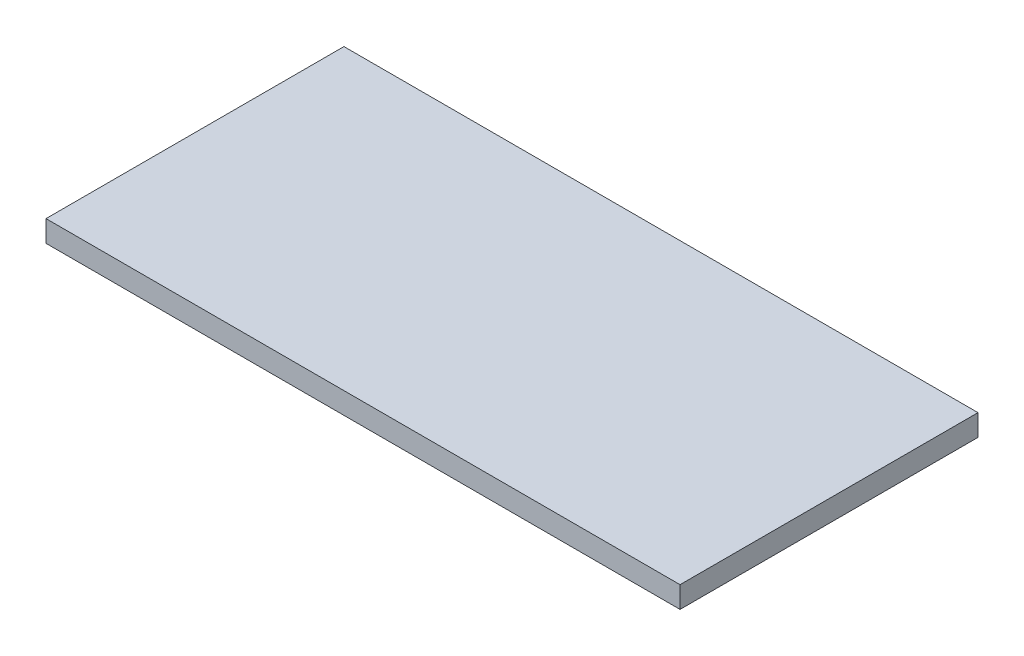
from build123d import *

# Parameters (mm, degrees)
SKETCH1_W           = 532
SKETCH1_H           = 250
BOSS_EXTRUDE1_DEPTH = 18


with BuildPart() as part:
    # Sketch1 → Boss-Extrude1 (new body)
    with BuildSketch(Plane(origin=(0, 0, 0), x_dir=(1, 0, 0), z_dir=(0, 1, 0))):
        Rectangle(SKETCH1_W, SKETCH1_H)
    extrude(amount=BOSS_EXTRUDE1_DEPTH)


solid = part.part
